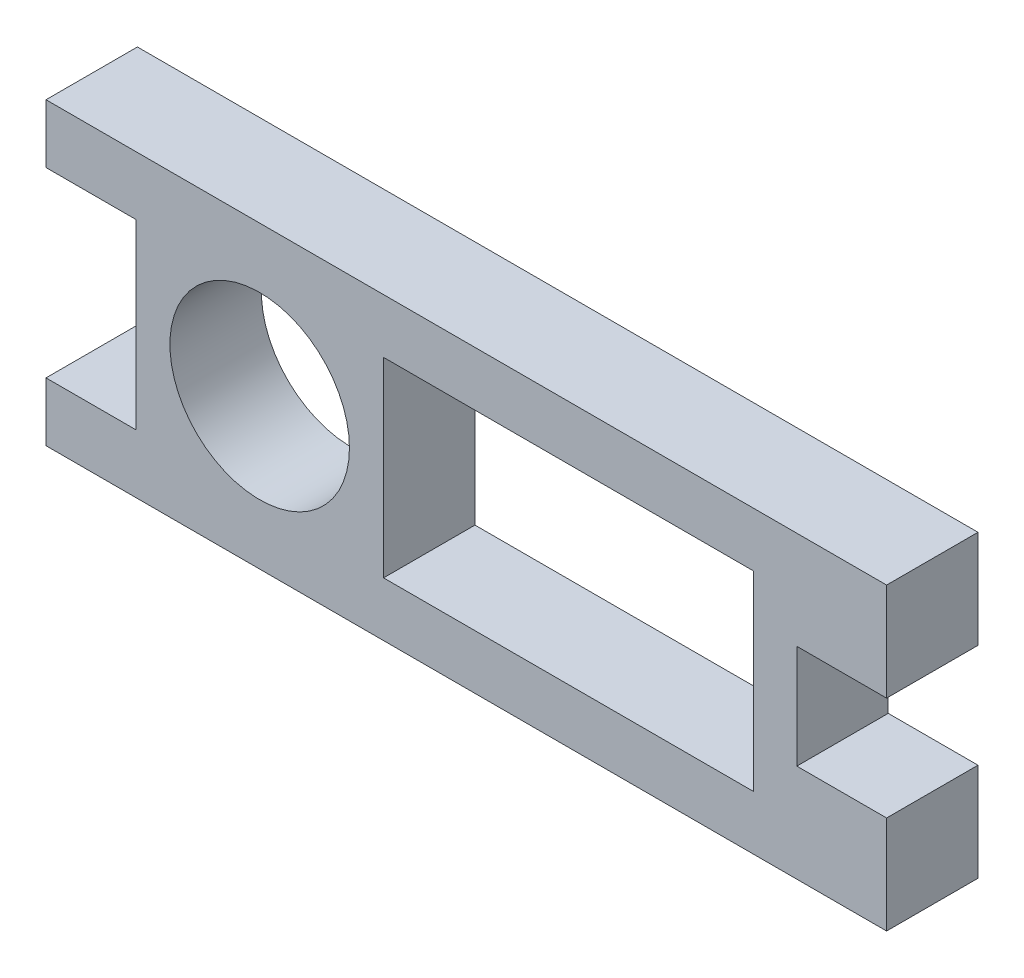
from build123d import *

# Parameters (mm, degrees)
SKETCH1_R           = 5.5
SKETCH1_W           = 22.669
SKETCH1_H           = 11.7
BOSS_EXTRUDE1_DEPTH = 5.6


with BuildPart() as part:
    # Sketch1 → Boss-Extrude1 (new body)
    with BuildSketch(Plane.XY):
        Polygon((702.290264671, 402.743983564), (702.290264671, 391.585983564), (696.790264671, 391.585983564), (696.790264671, 387.985983564), (748.290264671, 387.985983564), (748.290264671, 393.985983564), (742.790264671, 393.985983564), (742.790264671, 400.343983564), (748.290264671, 400.343983564), (748.290264671, 406.343983564), (696.790264671, 406.343983564), (696.790264671, 402.743983564), align=None)
        with Locations((709.880764671, 397.164983564)):
            Circle(SKETCH1_R, mode=Mode.SUBTRACT)
        with Locations((728.805764671, 397.164983564)):
            Rectangle(SKETCH1_W, SKETCH1_H, mode=Mode.SUBTRACT)
    extrude(amount=BOSS_EXTRUDE1_DEPTH)


solid = part.part
